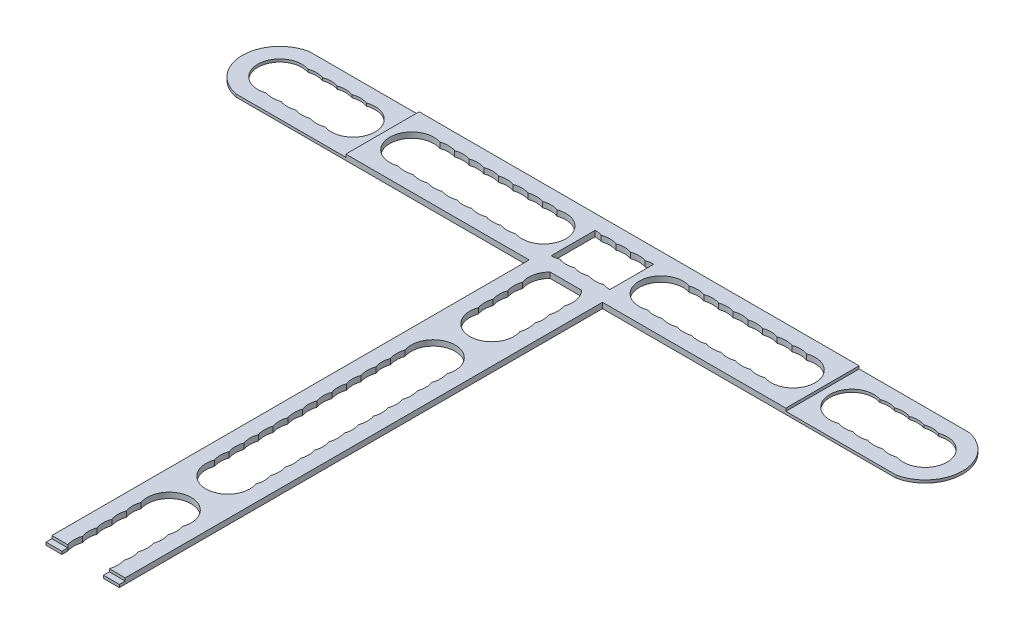
from build123d import *

# Parameters (mm, degrees)
BOSS_EXTRUDE1_DEPTH = 1.9
BOSS_EXTRUDE4_DEPTH = 0.95
BOSS_EXTRUDE2_DEPTH = 1.9
SKETCH5_W           = 5.428932188
SKETCH5_H           = 2
BOSS_EXTRUDE3_DEPTH = 0.95


with BuildPart() as part:
    # Sketch3 → Boss-Extrude1 (new body)
    with BuildSketch(Plane(origin=(0, 0, 0), x_dir=(1, 0, 0), z_dir=(0, 1, 0))):
        with BuildLine():
            Line((0, -7.5), (0, -12.5))
            Line((0, -12.5), (75, -12.5))
            Line((75, -12.5), (75, 12.5))
            Line((75, 12.5), (0, 12.5))
            Line((0, 12.5), (0, 7.5))
            ThreePointArc((0, 7.5), (1.26826484, 7.391989197), (2.5, 7.071067812))
            ThreePointArc((2.5, 7.071067812), (5, 7.5), (7.5, 7.071067812))
            ThreePointArc((7.5, 7.071067812), (8.73173516, 7.391989197), (10, 7.5))
            Line((10, 7.5), (10, -7.5))
            ThreePointArc((10, -7.5), (8.73173516, -7.391989197), (7.5, -7.071067812))
            ThreePointArc((7.5, -7.071067812), (5, -7.5), (2.5, -7.071067812))
            ThreePointArc((2.5, -7.071067812), (1.26826484, -7.391989197), (0, -7.5))
        make_face()
        with BuildLine():
            ThreePointArc((22.5, 7.071067812), (25, 7.5), (27.5, 7.071067812))
            ThreePointArc((27.5, 7.071067812), (30, 7.5), (32.5, 7.071067812))
            ThreePointArc((32.5, 7.071067812), (35, 7.5), (37.5, 7.071067812))
            ThreePointArc((37.5, 7.071067812), (40, 7.5), (42.5, 7.071067812))
            ThreePointArc((42.5, 7.071067812), (45, 7.5), (47.5, 7.071067812))
            ThreePointArc((47.5, 7.071067812), (50, 7.5), (52.5, 7.071067812))
            ThreePointArc((52.5, 7.071067812), (55, 7.5), (57.5, 7.071067812))
            ThreePointArc((57.5, 7.071067812), (60, 7.5), (62.5, 7.071067812))
            ThreePointArc((62.5, 7.071067812), (72.5, 0), (62.5, -7.071067812))
            ThreePointArc((62.5, -7.071067812), (60, -7.5), (57.5, -7.071067812))
            ThreePointArc((57.5, -7.071067812), (55, -7.5), (52.5, -7.071067812))
            ThreePointArc((52.5, -7.071067812), (50, -7.5), (47.5, -7.071067812))
            ThreePointArc((47.5, -7.071067812), (45, -7.5), (42.5, -7.071067812))
            ThreePointArc((42.5, -7.071067812), (40, -7.5), (37.5, -7.071067812))
            ThreePointArc((37.5, -7.071067812), (35, -7.5), (32.5, -7.071067812))
            ThreePointArc((32.5, -7.071067812), (30, -7.5), (27.5, -7.071067812))
            ThreePointArc((27.5, -7.071067812), (25, -7.5), (22.5, -7.071067812))
            ThreePointArc((22.5, -7.071067812), (12.5, 0), (22.5, 7.071067812))
        make_face(mode=Mode.SUBTRACT)
    boss_extrude1 = extrude(amount=BOSS_EXTRUDE1_DEPTH)

    # Sketch3<3> → Boss-Extrude4 (add)
    with BuildSketch(Plane(origin=(0, 0, 0), x_dir=(1, 0, 0), z_dir=(0, 1, 0))):
        with BuildLine():
            Line((75, -7.5), (75, -12.5))
            Line((75, -12.5), (112.5, -12.5))
            ThreePointArc((112.5, -12.5), (122.747548784, 0), (112.5, 12.5))
            Line((112.5, 12.5), (75, 12.5))
            Line((75, 12.5), (75, 7.5))
            ThreePointArc((75, 7.5), (76.26826484, 7.391989197), (77.5, 7.071067812))
            ThreePointArc((77.5, 7.071067812), (80, 7.5), (82.5, 7.071067812))
            ThreePointArc((82.5, 7.071067812), (85, 7.5), (87.5, 7.071067812))
            ThreePointArc((87.5, 7.071067812), (90, 7.5), (92.5, 7.071067812))
            ThreePointArc((92.5, 7.071067812), (95, 7.5), (97.5, 7.071067812))
            ThreePointArc((97.5, 7.071067812), (100, 7.5), (102.5, 7.071067812))
            ThreePointArc((102.5, 7.071067812), (105, 7.5), (107.5, 7.071067812))
            ThreePointArc((107.5, 7.071067812), (110, 7.5), (112.5, 7.071067812))
            ThreePointArc((112.5, 7.071067812), (117.5, 0), (112.5, -7.071067812))
            ThreePointArc((112.5, -7.071067812), (110, -7.5), (107.5, -7.071067812))
            ThreePointArc((107.5, -7.071067812), (105, -7.5), (102.5, -7.071067812))
            ThreePointArc((102.5, -7.071067812), (100, -7.5), (97.5, -7.071067812))
            ThreePointArc((97.5, -7.071067812), (95, -7.5), (92.5, -7.071067812))
            ThreePointArc((92.5, -7.071067812), (90, -7.5), (87.5, -7.071067812))
            ThreePointArc((87.5, -7.071067812), (85, -7.5), (82.5, -7.071067812))
            ThreePointArc((82.5, -7.071067812), (80, -7.5), (77.5, -7.071067812))
            ThreePointArc((77.5, -7.071067812), (76.26826484, -7.391989197), (75, -7.5))
        make_face()
        with BuildLine():
            Line((75, 7.5), (75, -7.5))
            ThreePointArc((75, -7.5), (76.26826484, -7.391989197), (77.5, -7.071067812))
            ThreePointArc((77.5, -7.071067812), (80, -7.5), (82.5, -7.071067812))
            ThreePointArc((82.5, -7.071067812), (77.5, 0), (82.5, 7.071067812))
            ThreePointArc((82.5, 7.071067812), (80, 7.5), (77.5, 7.071067812))
            ThreePointArc((77.5, 7.071067812), (76.26826484, 7.391989197), (75, 7.5))
        make_face()
    boss_extrude4 = extrude(amount=BOSS_EXTRUDE4_DEPTH)

    # Mirror1: Boss-Extrude1, Boss-Extrude4 across plane
    add(boss_extrude1.mirror(Plane(origin=(0, 0, 0), x_dir=(0, 0, 1), z_dir=(1, 0, 0))))
    add(boss_extrude4.mirror(Plane(origin=(0, 0, 0), x_dir=(0, 0, 1), z_dir=(1, 0, 0))))

    # Sketch4 → Boss-Extrude2 (add)
    with BuildSketch(Plane(origin=(0, 0, 0), x_dir=(1, 0, 0), z_dir=(0, 1, 0))):
        with BuildLine():
            Line((-12.5, -12.5), (-12.5, -175.214466094))
            Line((-12.5, -175.214466094), (-7.071067812, -175.214466094))
            ThreePointArc((-7.071067812, -175.214466094), (-7.5, -172.714466094), (-7.071067812, -170.214466094))
            ThreePointArc((-7.071067812, -170.214466094), (-7.5, -167.714466094), (-7.071067812, -165.214466094))
            ThreePointArc((-7.071067812, -165.214466094), (-7.5, -162.714466094), (-7.071067812, -160.214466094))
            ThreePointArc((-7.071067812, -160.214466094), (-7.5, -157.714466094), (-7.071067812, -155.214466094))
            ThreePointArc((-7.071067812, -155.214466094), (-7.5, -152.714466094), (-7.071067812, -150.214466094))
            ThreePointArc((-7.071067812, -150.214466094), (0, -140.214466094), (7.071067812, -150.214466094))
            ThreePointArc((7.071067812, -150.214466094), (7.5, -152.714466094), (7.071067812, -155.214466094))
            ThreePointArc((7.071067812, -155.214466094), (7.5, -157.714466094), (7.071067812, -160.214466094))
            ThreePointArc((7.071067812, -160.214466094), (7.5, -162.714466094), (7.071067812, -165.214466094))
            ThreePointArc((7.071067812, -165.214466094), (7.5, -167.714466094), (7.071067812, -170.214466094))
            ThreePointArc((7.071067812, -170.214466094), (7.5, -172.714466094), (7.071067812, -175.214466094))
            Line((7.071067812, -175.214466094), (12.5, -175.214466094))
            Line((12.5, -175.214466094), (12.5, -12.5))
            Line((12.5, -12.5), (5.390671883, -12.5))
            ThreePointArc((5.390671883, -12.5), (7.328163879, -16.118216063), (7.071067812, -20.214466094))
            ThreePointArc((7.071067812, -20.214466094), (7.5, -22.714466094), (7.071067812, -25.214466094))
            ThreePointArc((7.071067812, -25.214466094), (7.5, -27.714466094), (7.071067812, -30.214466094))
            ThreePointArc((7.071067812, -30.214466094), (7.5, -32.714466094), (7.071067812, -35.214466094))
            ThreePointArc((7.071067812, -35.214466094), (0, -45.214466094), (-7.071067812, -35.214466094))
            ThreePointArc((-7.071067812, -35.214466094), (-7.5, -32.714466094), (-7.071067812, -30.214466094))
            ThreePointArc((-7.071067812, -30.214466094), (-7.5, -27.714466094), (-7.071067812, -25.214466094))
            ThreePointArc((-7.071067812, -25.214466094), (-7.5, -22.714466094), (-7.071067812, -20.214466094))
            ThreePointArc((-7.071067812, -20.214466094), (-7.328163879, -16.118216063), (-5.390671883, -12.5))
            Line((-5.390671883, -12.5), (-12.5, -12.5))
        make_face()
        with BuildLine():
            ThreePointArc((7.071067812, -60.214466094), (7.5, -62.714466094), (7.071067812, -65.214466094))
            ThreePointArc((7.071067812, -65.214466094), (7.5, -67.714466094), (7.071067812, -70.214466094))
            ThreePointArc((7.071067812, -70.214466094), (7.5, -72.714466094), (7.071067812, -75.214466094))
            ThreePointArc((7.071067812, -75.214466094), (7.5, -77.714466094), (7.071067812, -80.214466094))
            ThreePointArc((7.071067812, -80.214466094), (7.5, -82.714466094), (7.071067812, -85.214466094))
            ThreePointArc((7.071067812, -85.214466094), (7.5, -87.714466094), (7.071067812, -90.214466094))
            ThreePointArc((7.071067812, -90.214466094), (7.5, -92.714466094), (7.071067812, -95.214466094))
            ThreePointArc((7.071067812, -95.214466094), (7.5, -97.714466094), (7.071067812, -100.214466094))
            ThreePointArc((7.071067812, -100.214466094), (7.5, -102.714466094), (7.071067812, -105.214466094))
            ThreePointArc((7.071067812, -105.214466094), (7.5, -107.714466094), (7.071067812, -110.214466094))
            ThreePointArc((7.071067812, -110.214466094), (7.5, -112.714466094), (7.071067812, -115.214466094))
            ThreePointArc((7.071067812, -115.214466094), (7.5, -117.714466094), (7.071067812, -120.214466094))
            ThreePointArc((7.071067812, -120.214466094), (7.5, -122.714466094), (7.071067812, -125.214466094))
            ThreePointArc((7.071067812, -125.214466094), (0, -135.214466094), (-7.071067812, -125.214466094))
            ThreePointArc((-7.071067812, -125.214466094), (-7.5, -122.714466094), (-7.071067812, -120.214466094))
            ThreePointArc((-7.071067812, -120.214466094), (-7.5, -117.714466094), (-7.071067812, -115.214466094))
            ThreePointArc((-7.071067812, -115.214466094), (-7.5, -112.714466094), (-7.071067812, -110.214466094))
            ThreePointArc((-7.071067812, -110.214466094), (-7.5, -107.714466094), (-7.071067812, -105.214466094))
            ThreePointArc((-7.071067812, -105.214466094), (-7.5, -102.714466094), (-7.071067812, -100.214466094))
            ThreePointArc((-7.071067812, -100.214466094), (-7.5, -97.714466094), (-7.071067812, -95.214466094))
            ThreePointArc((-7.071067812, -95.214466094), (-7.5, -92.714466094), (-7.071067812, -90.214466094))
            ThreePointArc((-7.071067812, -90.214466094), (-7.5, -87.714466094), (-7.071067812, -85.214466094))
            ThreePointArc((-7.071067812, -85.214466094), (-7.5, -82.714466094), (-7.071067812, -80.214466094))
            ThreePointArc((-7.071067812, -80.214466094), (-7.5, -77.714466094), (-7.071067812, -75.214466094))
            ThreePointArc((-7.071067812, -75.214466094), (-7.5, -72.714466094), (-7.071067812, -70.214466094))
            ThreePointArc((-7.071067812, -70.214466094), (-7.5, -67.714466094), (-7.071067812, -65.214466094))
            ThreePointArc((-7.071067812, -65.214466094), (-7.5, -62.714466094), (-7.071067812, -60.214466094))
            ThreePointArc((-7.071067812, -60.214466094), (0, -50.214466094), (7.071067812, -60.214466094))
        make_face(mode=Mode.SUBTRACT)
    extrude(amount=BOSS_EXTRUDE2_DEPTH)

    # Sketch5 → Boss-Extrude3 (add)
    with BuildSketch(Plane(origin=(0, 0, 0), x_dir=(1, 0, 0), z_dir=(0, 1, 0))):
        with Locations((-9.785533906, -176.214466094)):
            Rectangle(SKETCH5_W, SKETCH5_H)
        with Locations((9.785533906, -176.214466094)):
            Rectangle(SKETCH5_W, SKETCH5_H)
    extrude(amount=BOSS_EXTRUDE3_DEPTH)


solid = part.part
